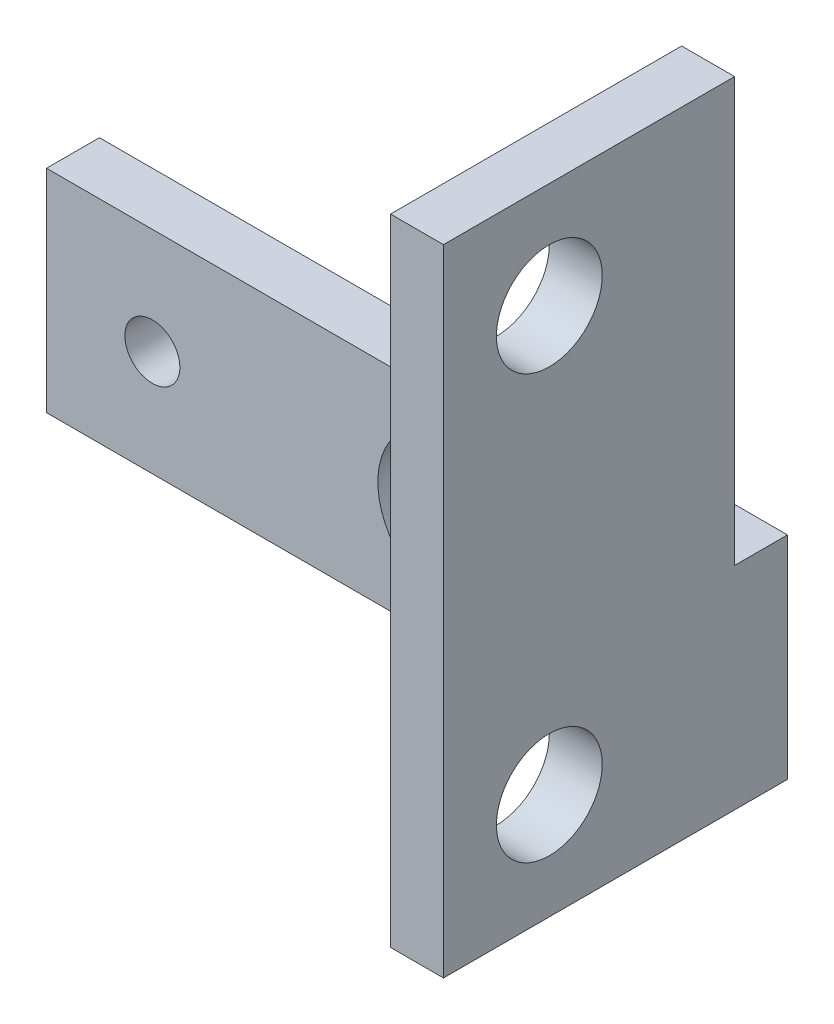
from build123d import *

# Parameters (mm, degrees)
SKETCH1_W           = 82.55
SKETCH1_H           = 25.4
BOSS_EXTRUDE1_DEPTH = 6.35
SKETCH2_W           = 6.35
SKETCH2_H           = 25.4
BOSS_EXTRUDE2_DEPTH = 34.925
SKETCH4_R           = 6.35
CUT_EXTRUDE1_DEPTH  = 96.725065291
SKETCH5_R           = 3.302
SKETCH5_R_2         = 9.144
CUT_EXTRUDE2_DEPTH  = 38.1
SKETCH6_W           = 6.35
SKETCH6_H           = 34.925
BOSS_EXTRUDE3_DEPTH = 50.8
SKETCH7_R           = 6.35
CUT_EXTRUDE3_DEPTH  = 120.685287839


with BuildPart() as part:
    # Sketch1 → Boss-Extrude1 (new body)
    with BuildSketch(Plane.XY):
        with Locations((41.275, 12.7)):
            Rectangle(SKETCH1_W, SKETCH1_H)
    extrude(amount=BOSS_EXTRUDE1_DEPTH)

    # Sketch2 → Boss-Extrude2 (add)
    with BuildSketch(Plane.XY.offset(6.35)):
        with Locations((79.375, 12.7)):
            Rectangle(SKETCH2_W, SKETCH2_H)
    extrude(amount=BOSS_EXTRUDE2_DEPTH)

    # Sketch4 → Cut-Extrude1 (cut, through all)
    with BuildSketch(Plane(origin=(82.55, 0, 0), x_dir=(0, 0, -1), z_dir=(1, 0, 0))):
        with Locations((-28.575, 12.7)):
            Circle(SKETCH4_R)
    extrude(amount=-CUT_EXTRUDE1_DEPTH, mode=Mode.SUBTRACT)

    # Sketch5 → Cut-Extrude2 (cut)
    with BuildSketch(Plane.XY.offset(6.35)):
        with Locations((12.7, 12.7)):
            Circle(SKETCH5_R)
        with Locations((48.895, 12.7)):
            Circle(SKETCH5_R_2)
    extrude(amount=-CUT_EXTRUDE2_DEPTH, mode=Mode.SUBTRACT)

    # Sketch6 → Boss-Extrude3 (add)
    with BuildSketch(Plane(origin=(0, 25.4, 0), x_dir=(1, 0, 0), z_dir=(0, 1, 0))):
        with Locations((79.375, -23.8125)):
            Rectangle(SKETCH6_W, SKETCH6_H)
    extrude(amount=BOSS_EXTRUDE3_DEPTH)

    # Sketch7 → Cut-Extrude3 (cut, through all)
    with BuildSketch(Plane(origin=(82.55, 0, 0), x_dir=(0, 0, -1), z_dir=(1, 0, 0))):
        with Locations((-28.575, 63.5)):
            Circle(SKETCH7_R)
    extrude(amount=-CUT_EXTRUDE3_DEPTH, mode=Mode.SUBTRACT)


solid = part.part
